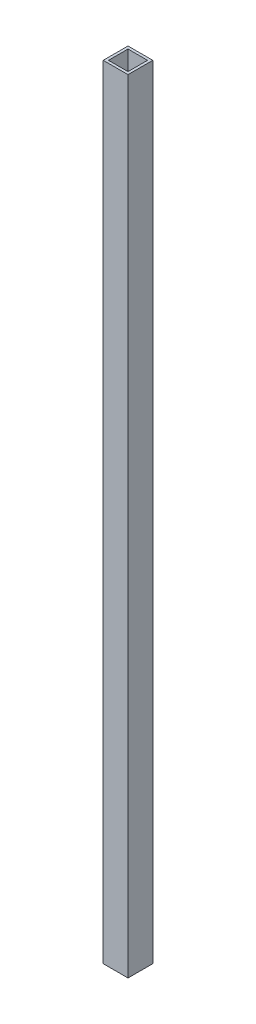
from build123d import *

# Parameters (mm, degrees)
SKETCH1_W           = 19
SKETCH1_H           = 19
SKETCH1_W_2         = 15
SKETCH1_H_2         = 15
EXTRUDE_THIN1_DEPTH = 600


with BuildPart() as part:
    # Sketch1 → Extrude-Thin1 (new body)
    with BuildSketch(Plane(origin=(0, 0, 0), x_dir=(1, 0, 0), z_dir=(0, 1, 0))):
        Rectangle(SKETCH1_W, SKETCH1_H)
        Rectangle(SKETCH1_W_2, SKETCH1_H_2, mode=Mode.SUBTRACT)
    extrude(amount=EXTRUDE_THIN1_DEPTH)


solid = part.part
